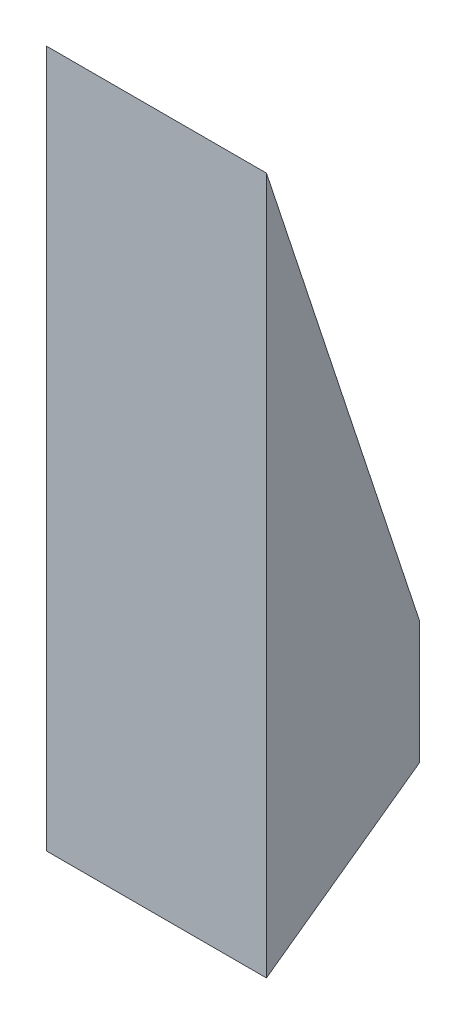
from build123d import *

# Parameters (mm, degrees)
SALIENTE_EXTRUIR1_DEPTH    = 172
VACIADO2_T                 = -2
SALIENTE_EXTRUIR2_DEPTH    = 30
CORTAR_EXTRUIR2_DEPTH      = 186.698680663
CORTAR_EXTRUIR2_DEPTH_BACK = 186.698680663
CORTAR_EXTRUIR3_DEPTH      = 184.847763109
CORTAR_EXTRUIR3_DEPTH_BACK = 25
CROQUIS8_R                 = 3.75
CORTAR_EXTRUIR4_DEPTH      = 186.698680663
CORTAR_EXTRUIR4_DEPTH_BACK = 186.698680663
CROQUIS9_W                 = 61.645841287
CROQUIS9_H                 = 31
CORTAR_EXTRUIR5_DEPTH      = 158.419820861
CORTAR_EXTRUIR5_DEPTH_BACK = 158.419820861


with BuildPart() as part:
    # Croquis1 → Saliente-Extruir1 (new body)
    with BuildSketch(Plane(origin=(0, 0, 0), x_dir=(1, 0, 0), z_dir=(0, 1, 0))):
        Polygon((27, 0), (-27, 0), (0, 64.58327957), align=None)
    extrude(amount=SALIENTE_EXTRUIR1_DEPTH)

    # Vaciado2
    vaciado2_openings = [part.faces().sort_by_distance(p)[0] for p in [
        (0, 172, -21.527759857),
    ]]
    offset(amount=VACIADO2_T, openings=vaciado2_openings, kind=Kind.INTERSECTION)

    # Croquis6 → Saliente-Extruir2 (add)
    with BuildSketch(Plane.XZ):
        Polygon((-27, 0), (27, 0), (0, -64.58327957), align=None)
    extrude(amount=SALIENTE_EXTRUIR2_DEPTH)

    # Croquis5 → Cortar-Extruir2 (cut, two sides: drawn at the far end of the back side and taken through both)
    with BuildSketch(Plane(origin=(0, 0, 0), x_dir=(0, 0, -1), z_dir=(1, 0, 0)).offset(-CORTAR_EXTRUIR2_DEPTH_BACK)):
        Polygon((4.522801595, 172), (64.58327957, 172), (64.58327957, 0), align=None)
    extrude(amount=CORTAR_EXTRUIR2_DEPTH + CORTAR_EXTRUIR2_DEPTH_BACK, mode=Mode.SUBTRACT)

    # Croquis8 → Cortar-Extruir3 (cut, two sides: drawn at the far end of the back side and taken through both)
    with BuildSketch(Plane(origin=(0, 2, 0), x_dir=(1, 0, 0), z_dir=(0, 1, 0)).offset(-CORTAR_EXTRUIR3_DEPTH_BACK)):
        with Locations(Location((0, 48.787977385, 0), (0, 0, 270))):
            Circle(CROQUIS8_R)
        with Locations(Location((0, 38.787977385, 0), (0, 0, 270))):
            Circle(CROQUIS8_R)
        with Locations(Location((0, 28.787977385, 0), (0, 0, 270))):
            Circle(CROQUIS8_R)
        with Locations(Location((0, 18.787977385, 0), (0, 0, 270))):
            Circle(CROQUIS8_R)
        with Locations(Location((0, 8.787977385, 0), (0, 0, 270))):
            Circle(CROQUIS8_R)
        with Locations(Location((10, 8.787977385, 0), (0, 0, 270))):
            Circle(CROQUIS8_R)
        with Locations(Location((-10, 8.787977385, 0), (0, 0, 270))):
            Circle(CROQUIS8_R)
        with Locations(Location((10, 18.787977385, 0), (0, 0, 270))):
            Circle(CROQUIS8_R)
        with Locations(Location((-10, 18.787977385, 0), (0, 0, 270))):
            Circle(CROQUIS8_R)
        with Locations(Location((8, 28.787977385, 0), (0, 0, 270))):
            Circle(CROQUIS8_R)
        with Locations(Location((-8, 28.787977385, 0), (0, 0, 270))):
            Circle(CROQUIS8_R)
    extrude(amount=CORTAR_EXTRUIR3_DEPTH + CORTAR_EXTRUIR3_DEPTH_BACK, mode=Mode.SUBTRACT)

    # Croquis9 → Cortar-Extruir4 (cut, two sides: drawn at the far end of the back side and taken through both)
    with BuildSketch(Plane(origin=(0, 0, 0), x_dir=(0, 0, -1), z_dir=(1, 0, 0)).offset(-CORTAR_EXTRUIR4_DEPTH_BACK)):
        with Locations((30.822920644, 156.5)):
            Rectangle(CROQUIS9_W, CROQUIS9_H)
    extrude(amount=CORTAR_EXTRUIR4_DEPTH + CORTAR_EXTRUIR4_DEPTH_BACK, mode=Mode.SUBTRACT)

    # Croquis10 → Cortar-Extruir5 (cut, two sides: drawn at the far end of the back side and taken through both)
    with BuildSketch(Plane(origin=(0, 0, 0), x_dir=(0, 0, -1), z_dir=(1, 0, 0)).offset(-CORTAR_EXTRUIR5_DEPTH_BACK)):
        Polygon((0, 141), (64.58327957, 0), (23.73241025, 141), align=None)
    extrude(amount=CORTAR_EXTRUIR5_DEPTH + CORTAR_EXTRUIR5_DEPTH_BACK, mode=Mode.SUBTRACT)


solid = part.part
